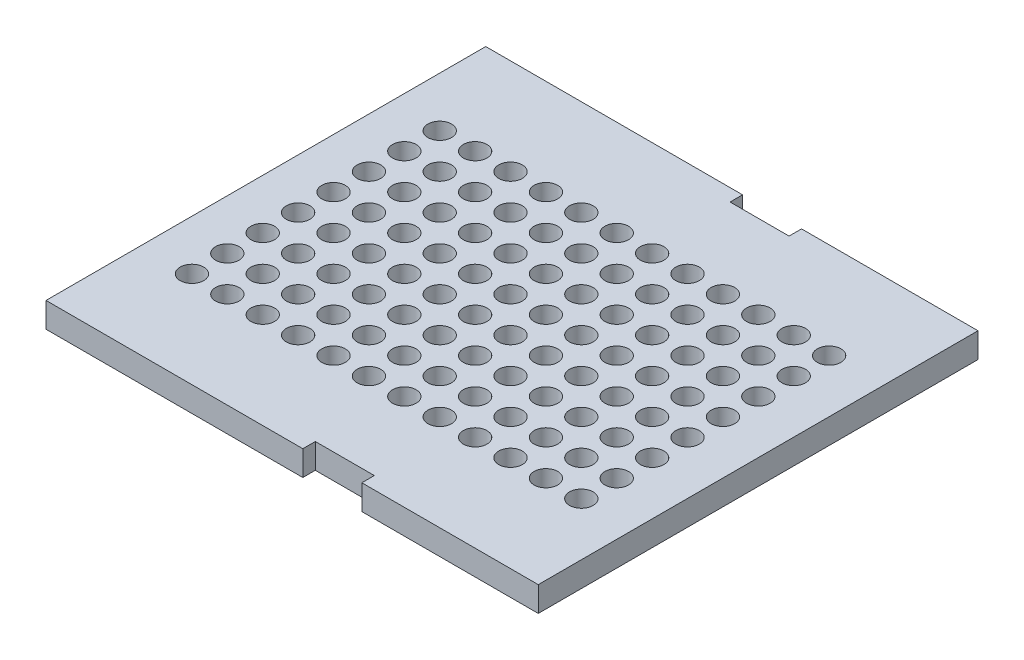
from build123d import *

# Parameters (mm, degrees)
SKETCH1_R           = 3
BOSS_EXTRUDE1_DEPTH = 6.35
SKETCH4_W           = 15
SKETCH4_H           = 3.175
CUT_EXTRUDE1_DEPTH  = 177.170678617


with BuildPart() as part:
    # Sketch1 → Boss-Extrude1 (new body)
    with BuildSketch(Plane(origin=(0, 0, 0), x_dir=(1, 0, 0), z_dir=(0, 1, 0))):
        Polygon((-69.296780506, 161.777959836), (55.697302316, 161.777959836), (55.697302316, 49.977959836), (51.130375465, 49.977959836), (3.340397506, 49.977959836), (-69.452697684, 49.977959836), (-69.452697684, 161.777959836), align=None)
        with Locations(Location((-56.752697684, 137.377959836, 0), (0, 0, 270))):
            Circle(SKETCH1_R, mode=Mode.SUBTRACT)
        with Locations(Location((-47.752697684, 137.377959836, 0), (0, 0, 270))):
            Circle(SKETCH1_R, mode=Mode.SUBTRACT)
        with Locations(Location((-38.752697684, 137.377959836, 0), (0, 0, 270))):
            Circle(SKETCH1_R, mode=Mode.SUBTRACT)
        with Locations(Location((-29.752697684, 137.377959836, 0), (0, 0, 270))):
            Circle(SKETCH1_R, mode=Mode.SUBTRACT)
        with Locations(Location((-20.752697684, 137.377959836, 0), (0, 0, 270))):
            Circle(SKETCH1_R, mode=Mode.SUBTRACT)
        with Locations(Location((-11.752697684, 137.377959836, 0), (0, 0, 270))):
            Circle(SKETCH1_R, mode=Mode.SUBTRACT)
        with Locations(Location((-2.752697684, 137.377959836, 0), (0, 0, 270))):
            Circle(SKETCH1_R, mode=Mode.SUBTRACT)
        with Locations(Location((6.247302316, 137.377959836, 0), (0, 0, 270))):
            Circle(SKETCH1_R, mode=Mode.SUBTRACT)
        with Locations(Location((15.247302316, 137.377959836, 0), (0, 0, 270))):
            Circle(SKETCH1_R, mode=Mode.SUBTRACT)
        with Locations(Location((24.247302316, 137.377959836, 0), (0, 0, 270))):
            Circle(SKETCH1_R, mode=Mode.SUBTRACT)
        with Locations(Location((33.247302316, 137.377959836, 0), (0, 0, 270))):
            Circle(SKETCH1_R, mode=Mode.SUBTRACT)
        with Locations(Location((42.247302316, 137.377959836, 0), (0, 0, 270))):
            Circle(SKETCH1_R, mode=Mode.SUBTRACT)
        with Locations(Location((-47.752697684, 128.377959836, 0), (0, 0, 270))):
            Circle(SKETCH1_R, mode=Mode.SUBTRACT)
        with Locations(Location((-38.752697684, 128.377959836, 0), (0, 0, 270))):
            Circle(SKETCH1_R, mode=Mode.SUBTRACT)
        with Locations(Location((-29.752697684, 128.377959836, 0), (0, 0, 270))):
            Circle(SKETCH1_R, mode=Mode.SUBTRACT)
        with Locations(Location((-20.752697684, 128.377959836, 0), (0, 0, 270))):
            Circle(SKETCH1_R, mode=Mode.SUBTRACT)
        with Locations(Location((-11.752697684, 128.377959836, 0), (0, 0, 270))):
            Circle(SKETCH1_R, mode=Mode.SUBTRACT)
        with Locations(Location((-2.752697684, 128.377959836, 0), (0, 0, 270))):
            Circle(SKETCH1_R, mode=Mode.SUBTRACT)
        with Locations(Location((6.247302316, 128.377959836, 0), (0, 0, 270))):
            Circle(SKETCH1_R, mode=Mode.SUBTRACT)
        with Locations(Location((15.247302316, 128.377959836, 0), (0, 0, 270))):
            Circle(SKETCH1_R, mode=Mode.SUBTRACT)
        with Locations(Location((24.247302316, 128.377959836, 0), (0, 0, 270))):
            Circle(SKETCH1_R, mode=Mode.SUBTRACT)
        with Locations(Location((33.247302316, 128.377959836, 0), (0, 0, 270))):
            Circle(SKETCH1_R, mode=Mode.SUBTRACT)
        with Locations(Location((42.247302316, 128.377959836, 0), (0, 0, 270))):
            Circle(SKETCH1_R, mode=Mode.SUBTRACT)
        with Locations(Location((-47.752697684, 119.377959836, 0), (0, 0, 270))):
            Circle(SKETCH1_R, mode=Mode.SUBTRACT)
        with Locations(Location((-38.752697684, 119.377959836, 0), (0, 0, 270))):
            Circle(SKETCH1_R, mode=Mode.SUBTRACT)
        with Locations(Location((-29.752697684, 119.377959836, 0), (0, 0, 270))):
            Circle(SKETCH1_R, mode=Mode.SUBTRACT)
        with Locations(Location((-20.752697684, 119.377959836, 0), (0, 0, 270))):
            Circle(SKETCH1_R, mode=Mode.SUBTRACT)
        with Locations(Location((-11.752697684, 119.377959836, 0), (0, 0, 270))):
            Circle(SKETCH1_R, mode=Mode.SUBTRACT)
        with Locations(Location((-2.752697684, 119.377959836, 0), (0, 0, 270))):
            Circle(SKETCH1_R, mode=Mode.SUBTRACT)
        with Locations(Location((6.247302316, 119.377959836, 0), (0, 0, 270))):
            Circle(SKETCH1_R, mode=Mode.SUBTRACT)
        with Locations(Location((15.247302316, 119.377959836, 0), (0, 0, 270))):
            Circle(SKETCH1_R, mode=Mode.SUBTRACT)
        with Locations(Location((24.247302316, 119.377959836, 0), (0, 0, 270))):
            Circle(SKETCH1_R, mode=Mode.SUBTRACT)
        with Locations(Location((33.247302316, 119.377959836, 0), (0, 0, 270))):
            Circle(SKETCH1_R, mode=Mode.SUBTRACT)
        with Locations(Location((42.247302316, 119.377959836, 0), (0, 0, 270))):
            Circle(SKETCH1_R, mode=Mode.SUBTRACT)
        with Locations(Location((-47.752697684, 110.377959836, 0), (0, 0, 270))):
            Circle(SKETCH1_R, mode=Mode.SUBTRACT)
        with Locations(Location((-38.752697684, 110.377959836, 0), (0, 0, 270))):
            Circle(SKETCH1_R, mode=Mode.SUBTRACT)
        with Locations(Location((-29.752697684, 110.377959836, 0), (0, 0, 270))):
            Circle(SKETCH1_R, mode=Mode.SUBTRACT)
        with Locations(Location((-20.752697684, 110.377959836, 0), (0, 0, 270))):
            Circle(SKETCH1_R, mode=Mode.SUBTRACT)
        with Locations(Location((-11.752697684, 110.377959836, 0), (0, 0, 270))):
            Circle(SKETCH1_R, mode=Mode.SUBTRACT)
        with Locations(Location((-2.752697684, 110.377959836, 0), (0, 0, 270))):
            Circle(SKETCH1_R, mode=Mode.SUBTRACT)
        with Locations(Location((6.247302316, 110.377959836, 0), (0, 0, 270))):
            Circle(SKETCH1_R, mode=Mode.SUBTRACT)
        with Locations(Location((15.247302316, 110.377959836, 0), (0, 0, 270))):
            Circle(SKETCH1_R, mode=Mode.SUBTRACT)
        with Locations(Location((24.247302316, 110.377959836, 0), (0, 0, 270))):
            Circle(SKETCH1_R, mode=Mode.SUBTRACT)
        with Locations(Location((33.247302316, 110.377959836, 0), (0, 0, 270))):
            Circle(SKETCH1_R, mode=Mode.SUBTRACT)
        with Locations(Location((42.247302316, 110.377959836, 0), (0, 0, 270))):
            Circle(SKETCH1_R, mode=Mode.SUBTRACT)
        with Locations(Location((-47.752697684, 101.377959836, 0), (0, 0, 270))):
            Circle(SKETCH1_R, mode=Mode.SUBTRACT)
        with Locations(Location((-38.752697684, 101.377959836, 0), (0, 0, 270))):
            Circle(SKETCH1_R, mode=Mode.SUBTRACT)
        with Locations(Location((-29.752697684, 101.377959836, 0), (0, 0, 270))):
            Circle(SKETCH1_R, mode=Mode.SUBTRACT)
        with Locations(Location((-20.752697684, 101.377959836, 0), (0, 0, 270))):
            Circle(SKETCH1_R, mode=Mode.SUBTRACT)
        with Locations(Location((-11.752697684, 101.377959836, 0), (0, 0, 270))):
            Circle(SKETCH1_R, mode=Mode.SUBTRACT)
        with Locations(Location((-2.752697684, 101.377959836, 0), (0, 0, 270))):
            Circle(SKETCH1_R, mode=Mode.SUBTRACT)
        with Locations(Location((6.247302316, 101.377959836, 0), (0, 0, 270))):
            Circle(SKETCH1_R, mode=Mode.SUBTRACT)
        with Locations(Location((15.247302316, 101.377959836, 0), (0, 0, 270))):
            Circle(SKETCH1_R, mode=Mode.SUBTRACT)
        with Locations(Location((24.247302316, 101.377959836, 0), (0, 0, 270))):
            Circle(SKETCH1_R, mode=Mode.SUBTRACT)
        with Locations(Location((33.247302316, 101.377959836, 0), (0, 0, 270))):
            Circle(SKETCH1_R, mode=Mode.SUBTRACT)
        with Locations(Location((42.247302316, 101.377959836, 0), (0, 0, 270))):
            Circle(SKETCH1_R, mode=Mode.SUBTRACT)
        with Locations(Location((-47.752697684, 92.377959836, 0), (0, 0, 270))):
            Circle(SKETCH1_R, mode=Mode.SUBTRACT)
        with Locations(Location((-38.752697684, 92.377959836, 0), (0, 0, 270))):
            Circle(SKETCH1_R, mode=Mode.SUBTRACT)
        with Locations(Location((-29.752697684, 92.377959836, 0), (0, 0, 270))):
            Circle(SKETCH1_R, mode=Mode.SUBTRACT)
        with Locations(Location((-20.752697684, 92.377959836, 0), (0, 0, 270))):
            Circle(SKETCH1_R, mode=Mode.SUBTRACT)
        with Locations(Location((-11.752697684, 92.377959836, 0), (0, 0, 270))):
            Circle(SKETCH1_R, mode=Mode.SUBTRACT)
        with Locations(Location((-2.752697684, 92.377959836, 0), (0, 0, 270))):
            Circle(SKETCH1_R, mode=Mode.SUBTRACT)
        with Locations(Location((6.247302316, 92.377959836, 0), (0, 0, 270))):
            Circle(SKETCH1_R, mode=Mode.SUBTRACT)
        with Locations(Location((15.247302316, 92.377959836, 0), (0, 0, 270))):
            Circle(SKETCH1_R, mode=Mode.SUBTRACT)
        with Locations(Location((24.247302316, 92.377959836, 0), (0, 0, 270))):
            Circle(SKETCH1_R, mode=Mode.SUBTRACT)
        with Locations(Location((33.247302316, 92.377959836, 0), (0, 0, 270))):
            Circle(SKETCH1_R, mode=Mode.SUBTRACT)
        with Locations(Location((42.247302316, 92.377959836, 0), (0, 0, 270))):
            Circle(SKETCH1_R, mode=Mode.SUBTRACT)
        with Locations(Location((-47.752697684, 83.377959836, 0), (0, 0, 270))):
            Circle(SKETCH1_R, mode=Mode.SUBTRACT)
        with Locations(Location((-38.752697684, 83.377959836, 0), (0, 0, 270))):
            Circle(SKETCH1_R, mode=Mode.SUBTRACT)
        with Locations(Location((-29.752697684, 83.377959836, 0), (0, 0, 270))):
            Circle(SKETCH1_R, mode=Mode.SUBTRACT)
        with Locations(Location((-20.752697684, 83.377959836, 0), (0, 0, 270))):
            Circle(SKETCH1_R, mode=Mode.SUBTRACT)
        with Locations(Location((-11.752697684, 83.377959836, 0), (0, 0, 270))):
            Circle(SKETCH1_R, mode=Mode.SUBTRACT)
        with Locations(Location((-2.752697684, 83.377959836, 0), (0, 0, 270))):
            Circle(SKETCH1_R, mode=Mode.SUBTRACT)
        with Locations(Location((6.247302316, 83.377959836, 0), (0, 0, 270))):
            Circle(SKETCH1_R, mode=Mode.SUBTRACT)
        with Locations(Location((15.247302316, 83.377959836, 0), (0, 0, 270))):
            Circle(SKETCH1_R, mode=Mode.SUBTRACT)
        with Locations(Location((24.247302316, 83.377959836, 0), (0, 0, 270))):
            Circle(SKETCH1_R, mode=Mode.SUBTRACT)
        with Locations(Location((33.247302316, 83.377959836, 0), (0, 0, 270))):
            Circle(SKETCH1_R, mode=Mode.SUBTRACT)
        with Locations(Location((42.247302316, 83.377959836, 0), (0, 0, 270))):
            Circle(SKETCH1_R, mode=Mode.SUBTRACT)
        with Locations(Location((-47.752697684, 74.377959836, 0), (0, 0, 270))):
            Circle(SKETCH1_R, mode=Mode.SUBTRACT)
        with Locations(Location((-38.752697684, 74.377959836, 0), (0, 0, 270))):
            Circle(SKETCH1_R, mode=Mode.SUBTRACT)
        with Locations(Location((-29.752697684, 74.377959836, 0), (0, 0, 270))):
            Circle(SKETCH1_R, mode=Mode.SUBTRACT)
        with Locations(Location((-20.752697684, 74.377959836, 0), (0, 0, 270))):
            Circle(SKETCH1_R, mode=Mode.SUBTRACT)
        with Locations(Location((-11.752697684, 74.377959836, 0), (0, 0, 270))):
            Circle(SKETCH1_R, mode=Mode.SUBTRACT)
        with Locations(Location((-2.752697684, 74.377959836, 0), (0, 0, 270))):
            Circle(SKETCH1_R, mode=Mode.SUBTRACT)
        with Locations(Location((6.247302316, 74.377959836, 0), (0, 0, 270))):
            Circle(SKETCH1_R, mode=Mode.SUBTRACT)
        with Locations(Location((15.247302316, 74.377959836, 0), (0, 0, 270))):
            Circle(SKETCH1_R, mode=Mode.SUBTRACT)
        with Locations(Location((24.247302316, 74.377959836, 0), (0, 0, 270))):
            Circle(SKETCH1_R, mode=Mode.SUBTRACT)
        with Locations(Location((33.247302316, 74.377959836, 0), (0, 0, 270))):
            Circle(SKETCH1_R, mode=Mode.SUBTRACT)
        with Locations(Location((42.247302316, 74.377959836, 0), (0, 0, 270))):
            Circle(SKETCH1_R, mode=Mode.SUBTRACT)
        with Locations(Location((-56.752697684, 128.377959836, 0), (0, 0, 270))):
            Circle(SKETCH1_R, mode=Mode.SUBTRACT)
        with Locations(Location((-56.752697684, 119.377959836, 0), (0, 0, 270))):
            Circle(SKETCH1_R, mode=Mode.SUBTRACT)
        with Locations(Location((-56.752697684, 110.377959836, 0), (0, 0, 270))):
            Circle(SKETCH1_R, mode=Mode.SUBTRACT)
        with Locations(Location((-56.752697684, 101.377959836, 0), (0, 0, 270))):
            Circle(SKETCH1_R, mode=Mode.SUBTRACT)
        with Locations(Location((-56.752697684, 92.377959836, 0), (0, 0, 270))):
            Circle(SKETCH1_R, mode=Mode.SUBTRACT)
        with Locations(Location((-56.752697684, 83.377959836, 0), (0, 0, 270))):
            Circle(SKETCH1_R, mode=Mode.SUBTRACT)
        with Locations(Location((-56.752697684, 74.377959836, 0), (0, 0, 270))):
            Circle(SKETCH1_R, mode=Mode.SUBTRACT)
    extrude(amount=BOSS_EXTRUDE1_DEPTH)

    # Sketch4 → Cut-Extrude1 (cut, through all)
    with BuildSketch(Plane.XZ):
        with Locations((3.340397506, -51.565459836)):
            Rectangle(SKETCH4_W, SKETCH4_H)
        with Locations((3.340397506, -160.190459836)):
            Rectangle(SKETCH4_W, SKETCH4_H)
    extrude(amount=-CUT_EXTRUDE1_DEPTH, mode=Mode.SUBTRACT)


solid = part.part
